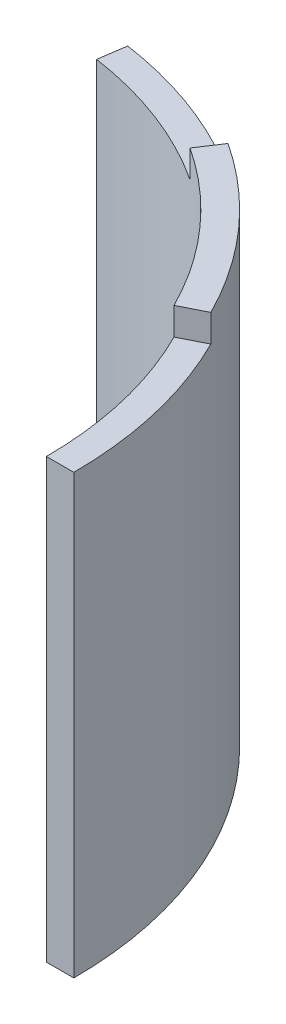
from build123d import *

# Parameters (mm, degrees)
BOSS_EXTRUDE1_DEPTH = 25.3500001
BOSS_EXTRUDE2_START = 3.175
BOSS_EXTRUDE2_DEPTH = 3.175


with BuildPart() as part:
    # Sketch1 → Boss-Extrude1 (new, symmetric)
    with BuildSketch(Plane(origin=(0, 0, 0), x_dir=(1, 0, 0), z_dir=(0, 1, 0))):
        with BuildLine():
            Line((6.278041701, 42.721172648), (6.739662414, 45.862435342))
            ThreePointArc((6.739662414, 45.862435342), (35.079930703, 30.30155915), (46.355, 0))
            Line((46.355, 0), (43.18, 0))
            ThreePointArc((43.18, 0), (32.677195723, 28.226109893), (6.278041701, 42.721172648))
        make_face()
    extrude(amount=BOSS_EXTRUDE1_DEPTH, both=True)

    # Sketch4 → Boss-Extrude2 (add)
    with BuildSketch(Plane(origin=(0, 25.3500001, 0), x_dir=(1, 0, 0), z_dir=(0, 1, 0)).offset(BOSS_EXTRUDE2_START)):
        with BuildLine():
            Line((41.434019217, 20.784803982), (38.596072695, 19.361187271))
            ThreePointArc((38.596072695, 19.361187271), (32.269899408, 28.690869492), (23.744585805, 36.065316371))
            Line((23.744585805, 36.065316371), (25.490511231, 38.717177869))
            ThreePointArc((25.490511231, 38.717177869), (34.642686129, 30.800492249), (41.434019217, 20.784803982))
        make_face()
    extrude(amount=-BOSS_EXTRUDE2_DEPTH)


solid = part.part
